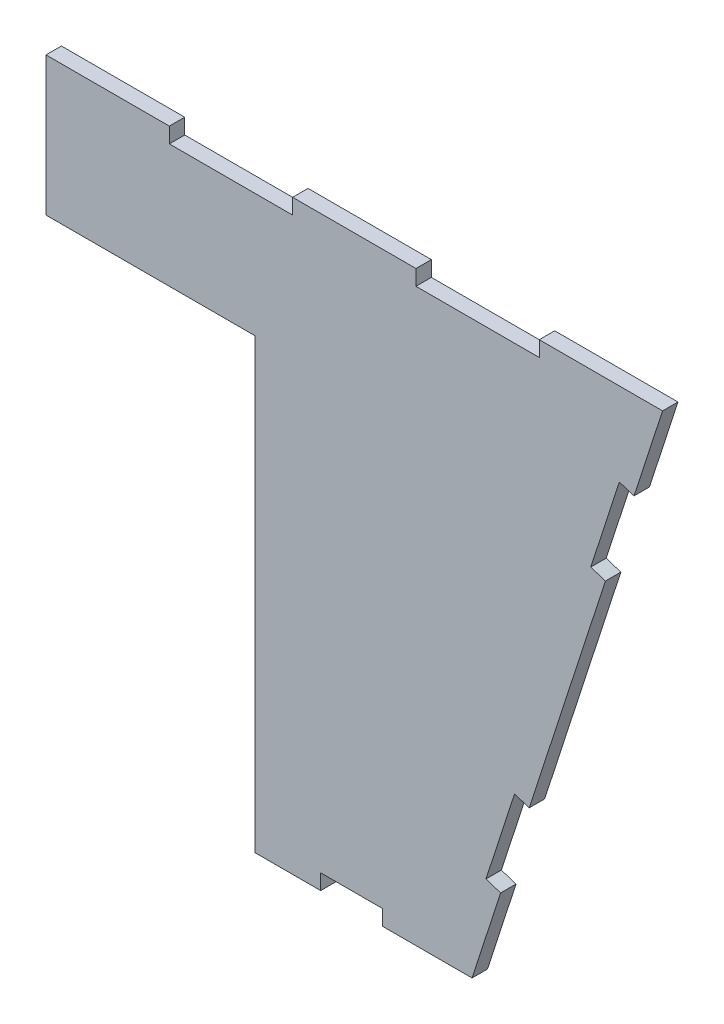
from build123d import *

# Parameters (mm, degrees)
BOSS_EXTRUDE1_DEPTH = 3.175


with BuildPart() as part:
    # Sketch1 → Boss-Extrude1 (new body)
    with BuildSketch(Plane.XY):
        Polygon((0, 0), (5.886773743, 18.117626635), (2.867169304, 19.098755593), (8.753943046, 37.216382228), (11.773547486, 36.235253271), (27.4716108, 84.548924299), (24.452006361, 85.530053256), (30.338780104, 103.647679891), (33.358384543, 102.666550934), (39.245158286, 120.784177569), (13.845158286, 120.784177569), (13.845158286, 117.609177569), (-11.554841714, 117.609177569), (-11.554841714, 120.784177569), (-36.954841714, 120.784177569), (-36.954841714, 117.609177569), (-62.354841714, 117.609177569), (-62.354841714, 120.784177569), (-87.754841714, 120.784177569), (-87.754841714, 92.209177569), (-44.659910515, 92.209177569), (-44.659910515, 0), (-31.177420857, 0), (-31.177420857, 3.175), (-18.477420857, 3.175), (-18.477420857, 0), align=None)
    extrude(amount=BOSS_EXTRUDE1_DEPTH)


solid = part.part
